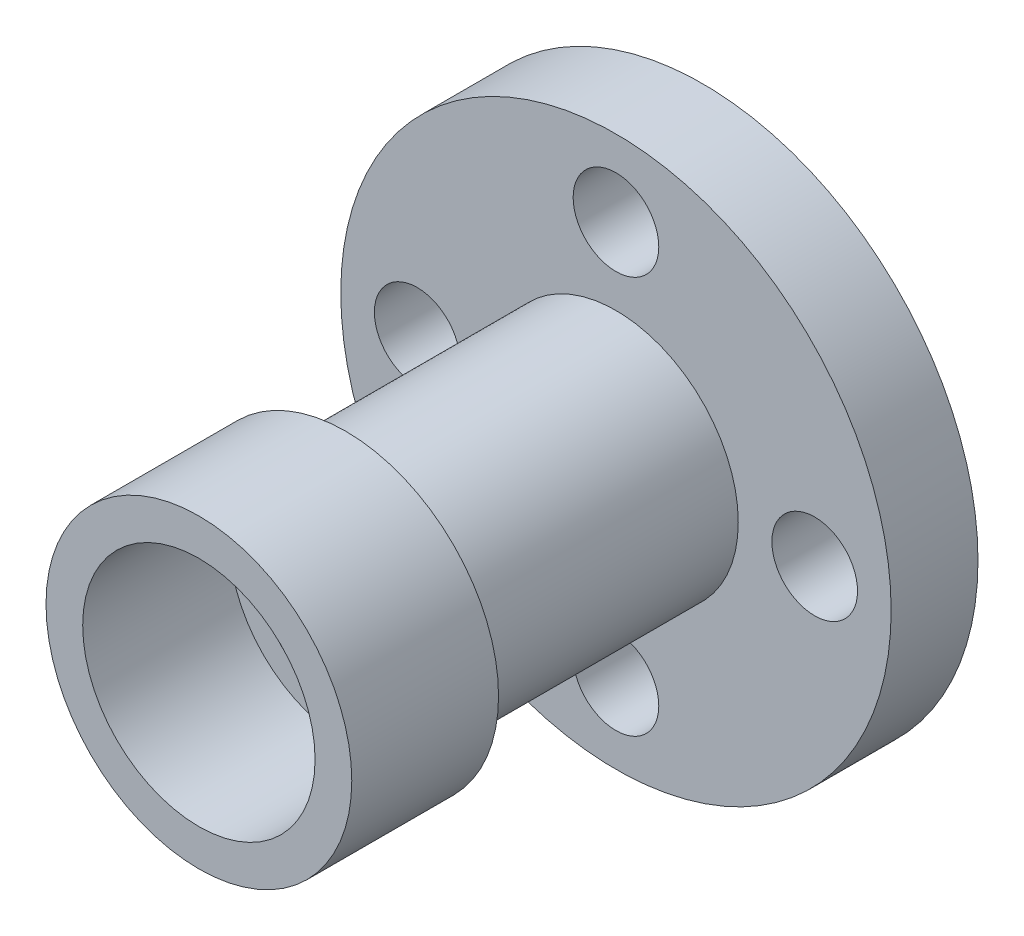
from build123d import *

# Parameters (mm, degrees)
CROQUIS1_R               = 45
SALIENTE_EXTRUIR1_DEPTH  = 14.2
CROQUIS6_R               = 15
SALIENTE_EXTRUIR13_DEPTH = 14
CROQUIS8_R               = 15
CORTAR_EXTRUIR3_DEPTH    = 16
CROQUIS2_R               = 20
SALIENTE_EXTRUIR3_DEPTH  = 58.4
CROQUIS3_R               = 25
CROQUIS3_R_2             = 19
SALIENTE_EXTRUIR4_DEPTH  = 24
CROQUIS5_R               = 15
CORTAR_EXTRUIR4_DEPTH    = 59
CROQUIS7_R               = 7
CORTAR_EXTRUIR18_DEPTH   = 17
CHAFL_N1_SIZE            = 3.5
CHAFL_N1_SIZE2           = 3


with BuildPart() as part:
    # Croquis1 → Saliente-Extruir1 (new body)
    with BuildSketch(Plane.XY):
        Circle(CROQUIS1_R)
    extrude(amount=SALIENTE_EXTRUIR1_DEPTH)

    # Croquis6 → Saliente-Extruir13 (add)
    with BuildSketch(Plane.XY.offset(14.2)):
        Circle(CROQUIS6_R)
    extrude(amount=-SALIENTE_EXTRUIR13_DEPTH)

    # Croquis8 → Cortar-Extruir3 (cut)
    with BuildSketch(Plane.XY.offset(14.2)):
        Circle(CROQUIS8_R)
    extrude(amount=-CORTAR_EXTRUIR3_DEPTH, mode=Mode.SUBTRACT)

    # Croquis2 → Saliente-Extruir3 (add)
    with BuildSketch(Plane.XY):
        Circle(CROQUIS2_R)
    extrude(amount=SALIENTE_EXTRUIR3_DEPTH)

    # Croquis3 → Saliente-Extruir4 (add)
    with BuildSketch(Plane.XY.offset(58.4)):
        Circle(CROQUIS3_R)
        Circle(CROQUIS3_R_2, mode=Mode.SUBTRACT)
    extrude(amount=SALIENTE_EXTRUIR4_DEPTH)

    # Croquis5 → Cortar-Extruir4 (cut)
    with BuildSketch(Plane.XY.offset(58.4)):
        Circle(CROQUIS5_R)
    extrude(amount=-CORTAR_EXTRUIR4_DEPTH, mode=Mode.SUBTRACT)

    # Croquis7 → Cortar-Extruir18 (cut)
    with BuildSketch(Plane(origin=(0, 0, 0), x_dir=(-1, 0, 0), z_dir=(0, 0, -1))):
        with Locations((0, 32.5)):
            Circle(CROQUIS7_R)
        with Locations((32.5, 0)):
            Circle(CROQUIS7_R)
        with Locations((0, -32.5)):
            Circle(CROQUIS7_R)
        with Locations((-32.5, 0)):
            Circle(CROQUIS7_R)
    extrude(amount=-CORTAR_EXTRUIR18_DEPTH, mode=Mode.SUBTRACT)

    # Chaflán1
    chafl_n1_edges = [part.edges().sort_by_distance(p)[0] for p in [
        (-15, 0, 0),
    ]]
    chafl_n1_side = [part.faces().sort_by_distance(p)[0] for p in [
        (-15, 0, 29.2),
    ]]
    chamfer(chafl_n1_edges, length=CHAFL_N1_SIZE, length2=CHAFL_N1_SIZE2, reference=chafl_n1_side[0])


solid = part.part
